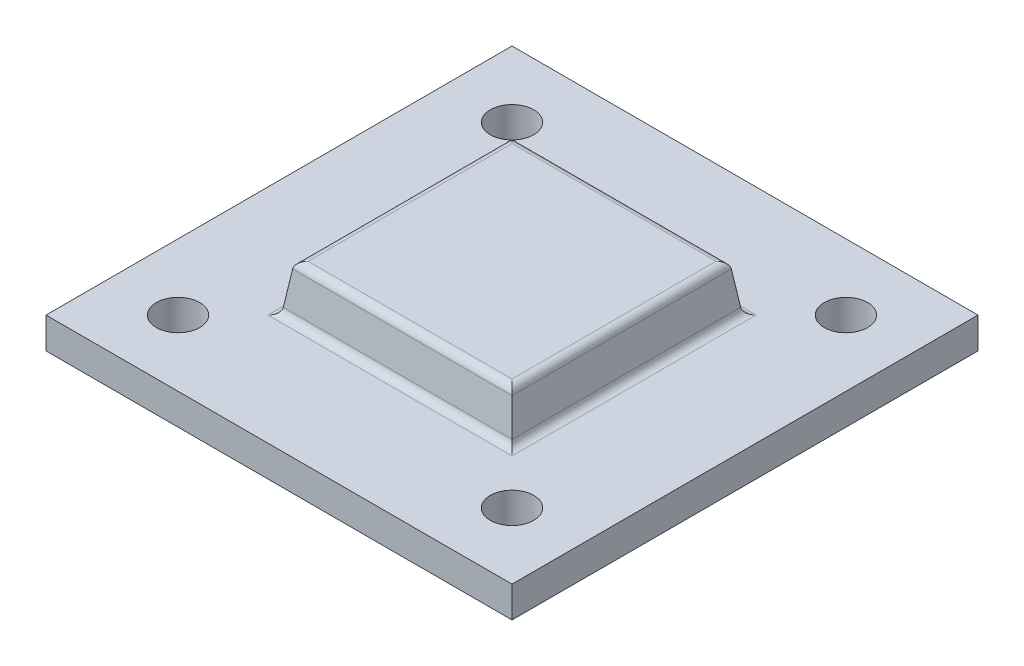
from build123d import *

# Parameters (mm, degrees)
SKETCH1_W           = 60
SKETCH1_H           = 60
BOSS_EXTRUDE1_DEPTH = 4
SKETCH2_W           = 28
SKETCH2_H           = 28
BOSS_EXTRUDE2_DEPTH = 6
DRAFT1_ANGLE        = 8
FILLET1_R           = 1
SKETCH3_R           = 2.794
CUT_EXTRUDE1_DEPTH  = 43.848570571


with BuildPart() as part:
    # Sketch1 → Boss-Extrude1 (new body)
    with BuildSketch(Plane(origin=(0, 0, 0), x_dir=(1, 0, 0), z_dir=(0, 1, 0))):
        Rectangle(SKETCH1_W, SKETCH1_H)
    extrude(amount=BOSS_EXTRUDE1_DEPTH)

    # Sketch2 → Boss-Extrude2 (add)
    with BuildSketch(Plane(origin=(0, 4, 0), x_dir=(1, 0, 0), z_dir=(0, 1, 0))):
        Rectangle(SKETCH2_W, SKETCH2_H)
    extrude(amount=BOSS_EXTRUDE2_DEPTH)

    # Draft1
    draft1_faces = [part.faces().sort_by_distance(p)[0] for p in [
        (-14, 7, 0),
        (0, 7, -14),
        (14, 7, 0),
        (0, 7, 14),
    ]]
    draft(draft1_faces, Plane.ZX.offset(10), DRAFT1_ANGLE)

    # Fillet1
    fillet1_edges = [part.edges().sort_by_distance(p)[0] for p in [
        (14.843245008, 4, 0),
        (0, 4, -14.843245008),
        (-14.843245008, 4, 0),
        (0, 4, 14.843245008),
        (14, 10, 0),
        (0, 10, -14),
        (-14, 10, 0),
        (0, 10, 14),
    ]]
    fillet(fillet1_edges, radius=FILLET1_R)

    # Sketch3 → Cut-Extrude1 (cut, through all)
    with BuildSketch(Plane(origin=(0, 4, 0), x_dir=(1, 0, 0), z_dir=(0, 1, 0))):
        with Locations(Location((-21.5, 21.5, 0), (0, 0, 270))):
            Circle(SKETCH3_R)
        with Locations(Location((21.5, 21.5, 0), (0, 0, 90))):
            Circle(SKETCH3_R)
        with Locations(Location((21.5, -21.5, 0), (0, 0, 270))):
            Circle(SKETCH3_R)
        with Locations(Location((-21.5, -21.5, 0), (0, 0, 90))):
            Circle(SKETCH3_R)
    extrude(amount=-CUT_EXTRUDE1_DEPTH, mode=Mode.SUBTRACT)


solid = part.part
